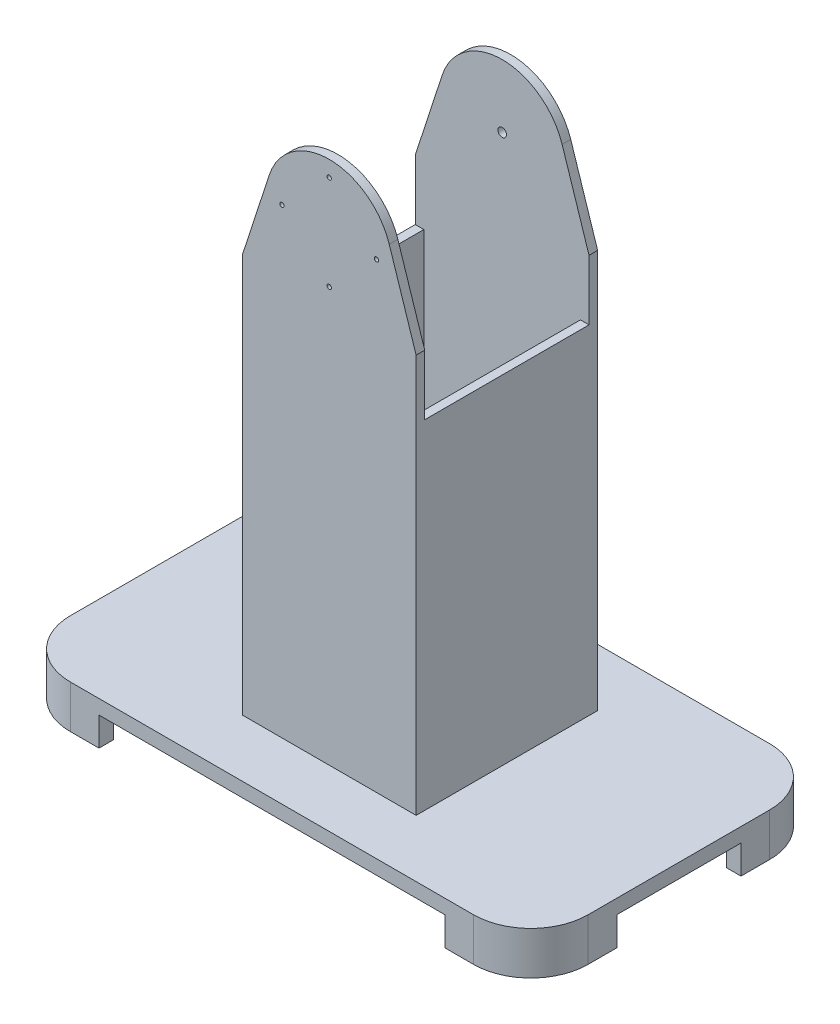
from build123d import *

# Parameters (mm, degrees)
SKETCH_1_W          = 60.6
SKETCH_1_H          = 63.3
SKETCH_1_W_2        = 54.6
SKETCH_1_H_2        = 57.3
EXTRUDE_1_DEPTH     = 118
SKETCH_2_W          = 60.6
SKETCH_2_H          = 3
EXTRUDE_2_DEPTH     = 65
CUT_EXTRUDE_1_DEPTH = 65
SKETCH_4_W          = 180.6
SKETCH_4_H          = 103.3
EXTRUDE_3_DEPTH     = 5
CUT_EXTRUDE_2_DEPTH = 5
EXTRUDE_START       = 10
EXTRUDE_4_DEPTH     = 10
SKETCH_8_R          = 0.75
CUT_EXTRUDE_3_DEPTH = 10
SKETCH_9_R          = 1.5
CUT_EXTRUDE_4_DEPTH = 10


with BuildPart() as part:
    # 草图1 → 凸台-拉伸1 (new body)
    with BuildSketch(Plane(origin=(0, 0, 0), x_dir=(1, 0, 0), z_dir=(0, 1, 0))):
        with Locations((-6.35625, -3.13125)):
            Rectangle(SKETCH_1_W, SKETCH_1_H)
        with Locations((-6.35625, -3.13125)):
            Rectangle(SKETCH_1_W_2, SKETCH_1_H_2, mode=Mode.SUBTRACT)
    extrude(amount=EXTRUDE_1_DEPTH)

    # 草图2 → 凸台-拉伸2 (add)
    with BuildSketch(Plane(origin=(0, 118, 0), x_dir=(1, 0, 0), z_dir=(0, 1, 0))):
        with Locations((-6.35625, 27.01875)):
            Rectangle(SKETCH_2_W, SKETCH_2_H)
        with Locations((-6.35625, -33.28125)):
            Rectangle(SKETCH_2_W, SKETCH_2_H)
    extrude(amount=EXTRUDE_2_DEPTH)

    # 草图3 → 切除-拉伸1 (cut)
    with BuildSketch(Plane(origin=(0, 0, -28.51875), x_dir=(-1, 0, 0), z_dir=(0, 0, -1))):
        with BuildLine():
            Line((36.65625, 183), (6.356250104, 183))
            ThreePointArc((6.356250104, 183), (19.282049563, 178.802351128), (27.275306551, 167.811246068))
            Line((27.275306551, 167.811246068), (36.65625, 139))
            Line((36.65625, 139), (36.65625, 183))
        make_face()
        with BuildLine():
            Line((-23.94375, 183), (-23.94375, 139))
            Line((-23.94375, 139), (-14.562806551, 167.811246068))
            ThreePointArc((-14.562806551, 167.811246068), (-6.569549479, 178.802351188), (6.356250104, 183))
            Line((6.356250104, 183), (-23.94375, 183))
        make_face()
    extrude(amount=-CUT_EXTRUDE_1_DEPTH, mode=Mode.SUBTRACT)

    # 草图4 → 凸台-拉伸3 (add)
    with BuildSketch(Plane.XZ):
        with Locations((-6.35625, 3.13125)):
            Rectangle(SKETCH_4_W, SKETCH_4_H)
    extrude(amount=EXTRUDE_3_DEPTH)

    # 草图5 → 切除-拉伸2 (cut)
    with BuildSketch(Plane.XZ.offset(5)):
        with BuildLine():
            ThreePointArc((-76.65625, -48.51875), (-90.798385624, -42.660885624), (-96.65625, -28.51875))
            Line((-96.65625, -28.51875), (-96.65625, -48.51875))
            Line((-96.65625, -48.51875), (-76.65625, -48.51875))
        make_face()
        with BuildLine():
            Line((-76.65625, 54.78125), (-86.65625, 54.78125))
            Line((-86.65625, 54.78125), (-96.65625, 54.78125))
            Line((-96.65625, 54.78125), (-96.65625, 34.78125))
            ThreePointArc((-96.65625, 34.78125), (-90.798385624, 48.923385624), (-76.65625, 54.78125))
        make_face()
        with BuildLine():
            Line((83.94375, 54.78125), (63.94375, 54.78125))
            ThreePointArc((63.94375, 54.78125), (78.085885624, 48.923385624), (83.94375, 34.78125))
            Line((83.94375, 34.78125), (83.94375, 54.78125))
        make_face()
        with BuildLine():
            Line((83.94375, -48.51875), (83.94375, -28.51875))
            ThreePointArc((83.94375, -28.51875), (78.085885624, -42.660885624), (63.94375, -48.51875))
            Line((63.94375, -48.51875), (83.94375, -48.51875))
        make_face()
    extrude(amount=-CUT_EXTRUDE_2_DEPTH, mode=Mode.SUBTRACT)

    # 草图6 → 凸台-拉伸4 (add)
    with BuildSketch(Plane.XZ.offset(5).offset(EXTRUDE_START)):
        with BuildLine():
            Line((-76.317762068, 49.78125), (-66.65625, 49.78125))
            Line((-66.65625, 49.78125), (-66.65625, 54.78125))
            Line((-66.65625, 54.78125), (-76.65625, 54.78125))
            ThreePointArc((-76.65625, 54.78125), (-90.798385624, 48.923385624), (-96.65625, 34.78125))
            Line((-96.65625, 34.78125), (-96.65625, 24.78125))
            Line((-96.65625, 24.78125), (-91.65625, 24.78125))
            Line((-91.65625, 24.78125), (-91.65625, 34.442762068))
            ThreePointArc((-91.65625, 34.442762068), (-87.265551911, 45.390551911), (-76.317762068, 49.78125))
        make_face()
        with BuildLine():
            Line((78.94375, 24.78125), (83.94375, 24.78125))
            Line((83.94375, 24.78125), (83.94375, 34.78125))
            ThreePointArc((83.94375, 34.78125), (78.085885624, 48.923385624), (63.94375, 54.78125))
            Line((63.94375, 54.78125), (53.94375, 54.78125))
            Line((53.94375, 54.78125), (53.94375, 49.78125))
            Line((53.94375, 49.78125), (63.605262068, 49.78125))
            ThreePointArc((63.605262068, 49.78125), (74.553051911, 45.390551911), (78.94375, 34.442762068))
            Line((78.94375, 34.442762068), (78.94375, 24.78125))
        make_face()
        with BuildLine():
            Line((78.94375, -28.180262068), (78.94375, -18.51875))
            Line((78.94375, -18.51875), (83.94375, -18.51875))
            Line((83.94375, -18.51875), (83.94375, -28.51875))
            ThreePointArc((83.94375, -28.51875), (78.085885624, -42.660885624), (63.94375, -48.51875))
            Line((63.94375, -48.51875), (53.94375, -48.51875))
            Line((53.94375, -48.51875), (53.94375, -43.51875))
            Line((53.94375, -43.51875), (63.605262068, -43.51875))
            ThreePointArc((63.605262068, -43.51875), (74.553051911, -39.128051911), (78.94375, -28.180262068))
        make_face()
        with BuildLine():
            Line((-91.65625, -18.51875), (-96.65625, -18.51875))
            Line((-96.65625, -18.51875), (-96.65625, -28.51875))
            ThreePointArc((-96.65625, -28.51875), (-90.798385624, -42.660885624), (-76.65625, -48.51875))
            Line((-76.65625, -48.51875), (-66.65625, -48.51875))
            Line((-66.65625, -48.51875), (-66.65625, -43.51875))
            Line((-66.65625, -43.51875), (-76.317762068, -43.51875))
            ThreePointArc((-76.317762068, -43.51875), (-87.265551911, -39.128051911), (-91.65625, -28.180262068))
            Line((-91.65625, -28.180262068), (-91.65625, -18.51875))
        make_face()
    extrude(amount=-EXTRUDE_4_DEPTH)

    # 草图8 → 切除-拉伸3 (cut)
    with BuildSketch(Plane.XY.offset(34.78125)):
        with Locations((-6.35625, 177.5)):
            Circle(SKETCH_8_R)
        with Locations((10.14375, 161)):
            Circle(SKETCH_8_R)
        with Locations((-6.35625, 144.5)):
            Circle(SKETCH_8_R)
        with Locations((-22.85625, 161)):
            Circle(SKETCH_8_R)
    extrude(amount=-CUT_EXTRUDE_3_DEPTH, mode=Mode.SUBTRACT)

    # 草图9 → 切除-拉伸4 (cut)
    with BuildSketch(Plane(origin=(0, 0, -28.51875), x_dir=(-1, 0, 0), z_dir=(0, 0, -1))):
        with Locations((6.35625, 161)):
            Circle(SKETCH_9_R)
    extrude(amount=-CUT_EXTRUDE_4_DEPTH, mode=Mode.SUBTRACT)


solid = part.part
